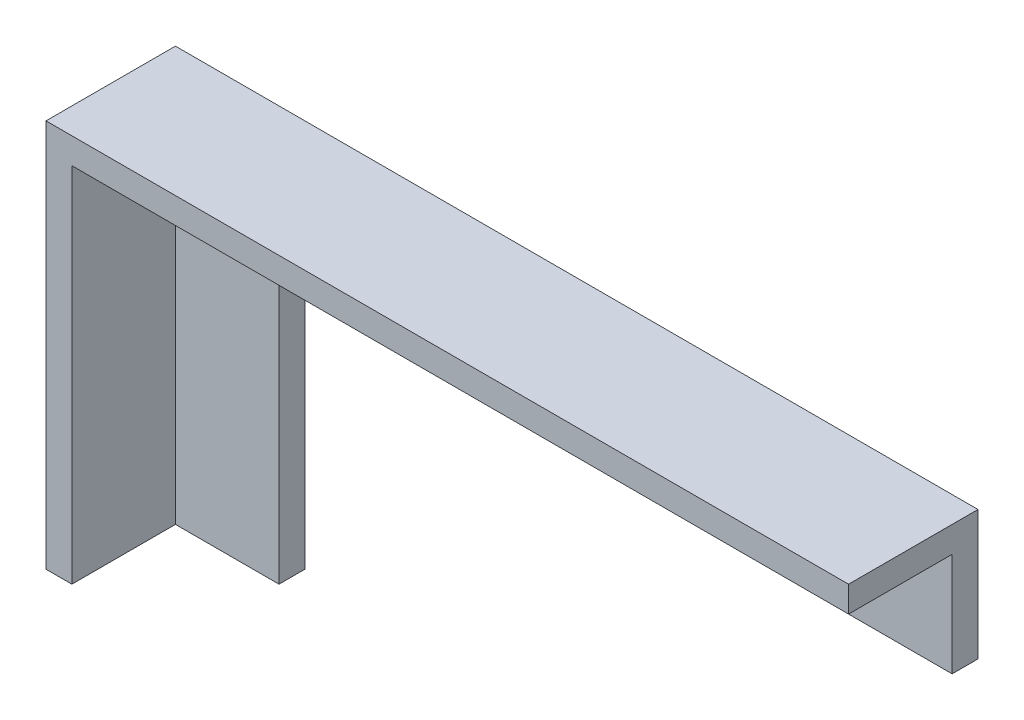
from build123d import *

# Parameters (mm, degrees)
BOSS_EXTRU_1_DEPTH      = 5
ENL_V_MAT_EXTRU_1_DEPTH = 4


with BuildPart() as part:
    # Esquisse1 → Boss.-Extru.1 (new body)
    with BuildSketch(Plane.XY):
        Polygon((0, 0), (31, 0), (31, -5), (5, -5), (5, -15), (0, -15), align=None)
    extrude(amount=BOSS_EXTRU_1_DEPTH)

    # Esquisse2 → Enlèv. mat.-Extru.1 (cut)
    with BuildSketch(Plane.XY.offset(5)):
        Polygon((1, -15), (5, -15), (5, -5), (31, -5), (31, -1), (1, -1), align=None)
    extrude(amount=-ENL_V_MAT_EXTRU_1_DEPTH, mode=Mode.SUBTRACT)


solid = part.part
